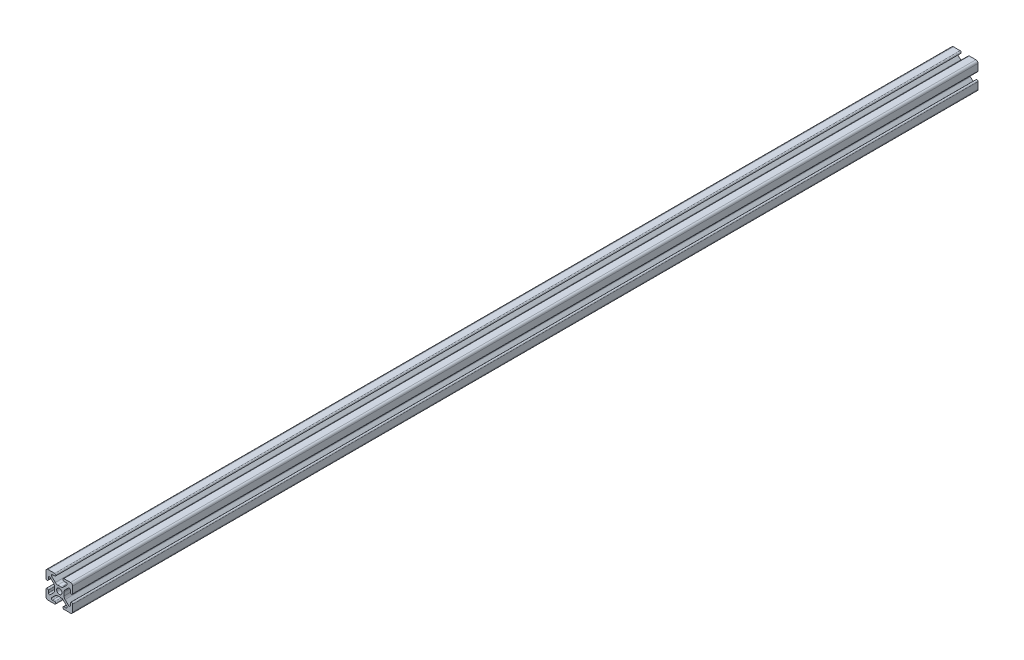
from build123d import *

# Parameters (mm, degrees)
SKETCH1_R           = 2.5
BOSS_EXTRUDE1_DEPTH = 850


with BuildPart() as part:
    # Sketch1 → Boss-Extrude1 (new body)
    with BuildSketch(Plane(origin=(0, 0, -25), x_dir=(-1, 0, 0), z_dir=(0, 0, -1))):
        with BuildLine():
            Line((12.5, 4.32), (12.5, 10.537068835))
            ThreePointArc((12.5, 10.537068835), (11.925070773, 11.925070773), (10.537068835, 12.5))
            Line((10.537068835, 12.5), (4.32, 12.5))
            ThreePointArc((4.32, 12.5), (3.25, 11.43), (4.32, 10.36))
            Line((4.32, 10.36), (6.42, 10.36))
            ThreePointArc((6.42, 10.36), (7.35325999, 9.736168088), (7.133653911, 8.635298598))
            Line((7.133653911, 8.635298598), (3.795290766, 5.301828272))
            ThreePointArc((3.795290766, 5.301828272), (2.76743922, 4.61585726), (1.555406707, 4.375))
            Line((1.555406707, 4.375), (-1.555406707, 4.375))
            ThreePointArc((-1.555406707, 4.375), (-2.76743922, 4.61585726), (-3.795290766, 5.301828272))
            Line((-3.795290766, 5.301828272), (-7.133653912, 8.635298598))
            ThreePointArc((-7.133653912, 8.635298598), (-7.35325999, 9.736168088), (-6.42, 10.36))
            Line((-6.42, 10.36), (-4.32, 10.36))
            ThreePointArc((-4.32, 10.36), (-3.25, 11.43), (-4.32, 12.5))
            Line((-4.32, 12.5), (-10.537068835, 12.5))
            ThreePointArc((-10.537068835, 12.5), (-11.925070773, 11.925070773), (-12.5, 10.537068835))
            Line((-12.5, 10.537068835), (-12.5, 4.32))
            ThreePointArc((-12.5, 4.32), (-11.43, 3.25), (-10.36, 4.32))
            Line((-10.36, 4.32), (-10.36, 6.396886949))
            ThreePointArc((-10.36, 6.396886949), (-9.736852394, 7.329863489), (-8.636346088, 7.111588351))
            Line((-8.636346088, 7.111588351), (-5.432204773, 3.912143135))
            ThreePointArc((-5.432204773, 3.912143135), (-4.708985779, 2.831057106), (-4.455, 1.555406707))
            Line((-4.455, 1.555406707), (-4.455, -1.555406707))
            ThreePointArc((-4.455, -1.555406707), (-4.708985779, -2.831057106), (-5.432204773, -3.912143135))
            Line((-5.432204773, -3.912143135), (-8.636346088, -7.111588351))
            ThreePointArc((-8.636346088, -7.111588351), (-9.736852394, -7.329863489), (-10.36, -6.396886949))
            Line((-10.36, -6.396886949), (-10.36, -4.32))
            ThreePointArc((-10.36, -4.32), (-11.43, -3.25), (-12.5, -4.32))
            Line((-12.5, -4.32), (-12.5, -10.537068835))
            ThreePointArc((-12.5, -10.537068835), (-11.925070773, -11.925070773), (-10.537068835, -12.5))
            Line((-10.537068835, -12.5), (-4.387856959, -12.5))
            ThreePointArc((-4.387856959, -12.5), (-3.317856959, -11.43), (-4.387856959, -10.36))
            Line((-4.387856959, -10.36), (-6.42, -10.36))
            ThreePointArc((-6.42, -10.36), (-7.35325999, -9.736168088), (-7.133653912, -8.635298598))
            Line((-7.133653912, -8.635298598), (-3.795290766, -5.301828272))
            ThreePointArc((-3.795290766, -5.301828272), (-2.76743922, -4.61585726), (-1.555406707, -4.375))
            Line((-1.555406707, -4.375), (1.555406707, -4.375))
            ThreePointArc((1.555406707, -4.375), (2.76743922, -4.61585726), (3.795290766, -5.301828272))
            Line((3.795290766, -5.301828272), (7.133653912, -8.635298598))
            ThreePointArc((7.133653912, -8.635298598), (7.35325999, -9.736168088), (6.42, -10.36))
            Line((6.42, -10.36), (4.387856959, -10.36))
            ThreePointArc((4.387856959, -10.36), (3.317856959, -11.43), (4.387856959, -12.5))
            Line((4.387856959, -12.5), (10.537068835, -12.5))
            ThreePointArc((10.537068835, -12.5), (11.925070773, -11.925070773), (12.5, -10.537068835))
            Line((12.5, -10.537068835), (12.5, -4.32))
            ThreePointArc((12.5, -4.32), (11.43, -3.25), (10.36, -4.32))
            Line((10.36, -4.32), (10.36, -6.396886949))
            ThreePointArc((10.36, -6.396886949), (9.736852394, -7.329863489), (8.636346088, -7.111588351))
            Line((8.636346088, -7.111588351), (5.432204773, -3.912143135))
            ThreePointArc((5.432204773, -3.912143135), (4.708985779, -2.831057106), (4.455, -1.555406707))
            Line((4.455, -1.555406707), (4.455, 1.555406707))
            ThreePointArc((4.455, 1.555406707), (4.708985779, 2.831057106), (5.432204773, 3.912143135))
            Line((5.432204773, 3.912143135), (8.636346088, 7.111588351))
            ThreePointArc((8.636346088, 7.111588351), (9.736852394, 7.329863489), (10.36, 6.396886949))
            Line((10.36, 6.396886949), (10.36, 4.32))
            ThreePointArc((10.36, 4.32), (11.43, 3.25), (12.5, 4.32))
        make_face()
        with Locations(Location((0, 0, 0), (0, 0, 180))):
            Circle(SKETCH1_R, mode=Mode.SUBTRACT)
    extrude(amount=-BOSS_EXTRUDE1_DEPTH)


solid = part.part
